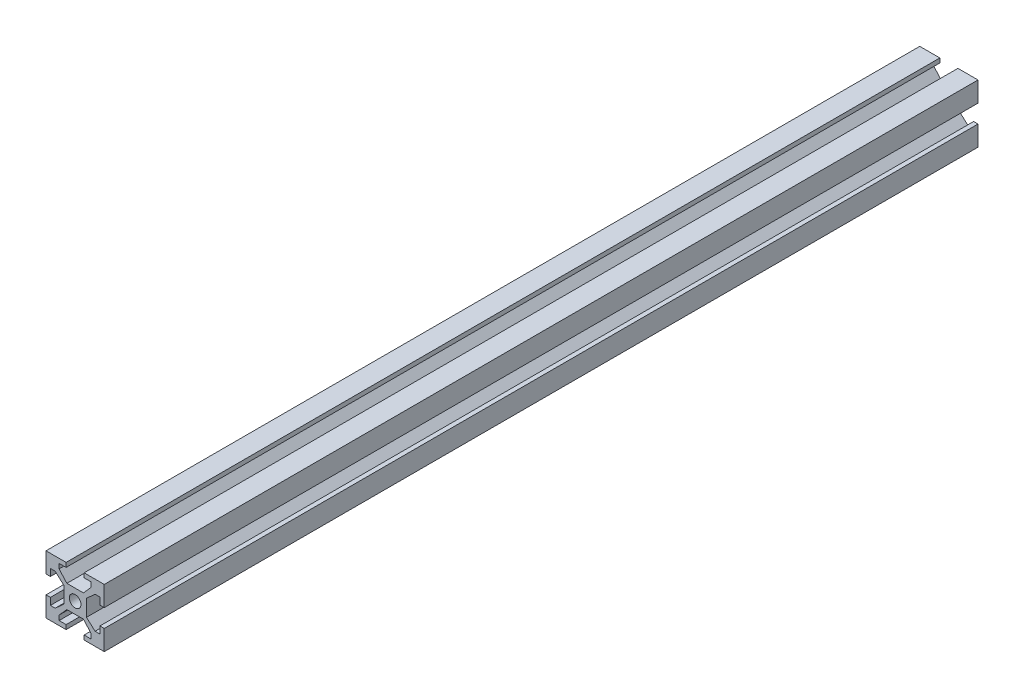
from build123d import *

# Parameters (mm, degrees)
SKETCH1_R           = 2
BOSS_EXTRUDE1_DEPTH = 150


with BuildPart() as part:
    # Sketch1 → Boss-Extrude1 (new, symmetric)
    with BuildSketch(Plane.XY):
        Polygon((10, 4.610379336), (10, 10), (4.610379336, 10), (3.1, 10), (3.1, 8.5), (5.5, 8.5), (5.5, 6.860660172), (2.839339828, 3.9), (0.519615242, 3.9), (-0.519615242, 3.9), (-2.839339828, 3.9), (-5.5, 6.860660172), (-5.5, 8.5), (-3.1, 8.5), (-3.1, 10), (-4.610379336, 10), (-10, 10), (-10, 4.610379336), (-10, 3.1), (-8.5, 3.1), (-8.5, 5.5), (-6.860660172, 5.5), (-3.9, 2.839339828), (-3.9, 0.519615242), (-3.9, -0.519615242), (-3.9, -2.839339828), (-6.860660172, -5.5), (-8.5, -5.5), (-8.5, -3.1), (-10, -3.1), (-10, -4.610379336), (-10, -10), (-4.610379336, -10), (-3.1, -10), (-3.1, -8.5), (-5.5, -8.5), (-5.5, -6.860660172), (-2.839339828, -3.9), (-0.519615242, -3.9), (0.519615242, -3.9), (2.839339828, -3.9), (5.5, -6.860660172), (5.5, -8.5), (3.1, -8.5), (3.1, -10), (4.610379336, -10), (10, -10), (10, -4.610379336), (10, -3.1), (8.5, -3.1), (8.5, -5.5), (6.860660172, -5.5), (3.9, -2.839339828), (3.9, -0.519615242), (3.9, 0.519615242), (3.9, 2.839339828), (6.860660172, 5.5), (8.5, 5.5), (8.5, 3.1), (10, 3.1), align=None)
        Circle(SKETCH1_R, mode=Mode.SUBTRACT)
    extrude(amount=BOSS_EXTRUDE1_DEPTH, both=True)


solid = part.part
